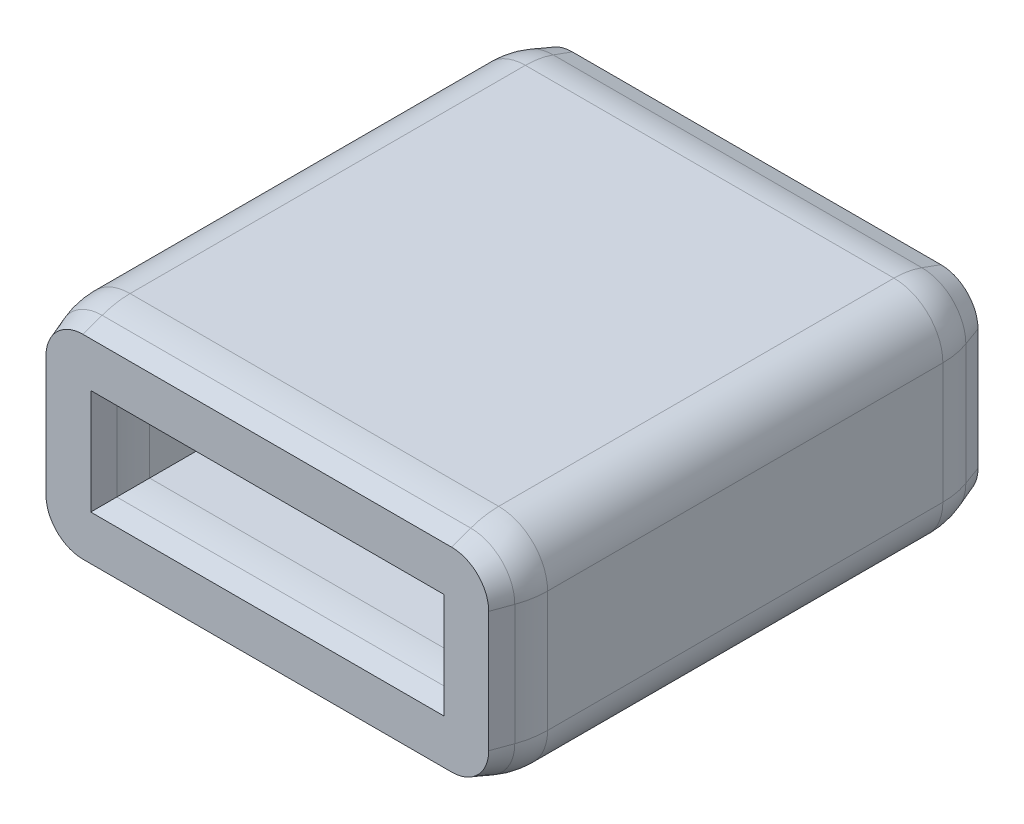
from build123d import *
from OCP.BRepFilletAPI import BRepFilletAPI_MakeChamfer

# Parameters (mm, degrees)
PROFILE_SKETCH_W         = 14.3
PROFILE_SKETCH_H         = 6.7
PROFILE_SKETCH_W_2       = 10.1
PROFILE_SKETCH_H_2       = 2.5
PROFILE_EXTRUDE_DEPTH    = 15
OUTSIDE_CORNER_FILLETS_R = 1.5
END_1_CHAMFER_SIZE       = 1
END_1_CHAMFER_SIZE2      = 0.363970234
END_2_CHAMFER_SIZE       = 1
END_2_CHAMFER_SIZE2      = 0.363970234
TRANSITION_FILLETS_R     = 2.5


with BuildPart() as part:
    # Profile Sketch → Profile Extrude (new body)
    with BuildSketch(Plane.XY):
        Rectangle(PROFILE_SKETCH_W, PROFILE_SKETCH_H)
        Rectangle(PROFILE_SKETCH_W_2, PROFILE_SKETCH_H_2, mode=Mode.SUBTRACT)
    extrude(amount=PROFILE_EXTRUDE_DEPTH)

    # Outside Corner Fillets
    outside_corner_fillets_edges = [part.edges().sort_by_distance(p)[0] for p in [
        (7.15, -3.35, 7.5),
        (-7.15, -3.35, 7.5),
        (-7.15, 3.35, 7.5),
        (7.15, 3.35, 7.5),
    ]]
    fillet(outside_corner_fillets_edges, radius=OUTSIDE_CORNER_FILLETS_R)

    # End 1 Chamfer: one chamfer whose edges measure the first distance from different faces: ONE call of the kernel's chamfer builder (chamfer() names one face for all edges)
    end_1_chamfer_edges_1 = [part.edges().sort_by_distance(p)[0] for p in [
        (5.05, 0, 15),
    ]]
    end_1_chamfer_side_1 = [part.faces().sort_by_distance(p)[0] for p in [
        (5.05, 0, 7.5),
    ]]
    end_1_chamfer_edges_2 = [part.edges().sort_by_distance(p)[0] for p in [
        (0, 1.25, 15),
    ]]
    end_1_chamfer_side_2 = [part.faces().sort_by_distance(p)[0] for p in [
        (0, 1.25, 7.5),
    ]]
    end_1_chamfer_edges_3 = [part.edges().sort_by_distance(p)[0] for p in [
        (-5.05, 0, 15),
    ]]
    end_1_chamfer_side_3 = [part.faces().sort_by_distance(p)[0] for p in [
        (-5.05, 0, 7.5),
    ]]
    end_1_chamfer_edges_4 = [part.edges().sort_by_distance(p)[0] for p in [
        (0, -1.25, 15),
    ]]
    end_1_chamfer_side_4 = [part.faces().sort_by_distance(p)[0] for p in [
        (0, -1.25, 7.5),
    ]]
    end_1_chamfer_edges_5 = [part.edges().sort_by_distance(p)[0] for p in [
        (0, 3.35, 0),
    ]]
    end_1_chamfer_side_5 = [part.faces().sort_by_distance(p)[0] for p in [
        (0, 3.35, 7.5),
    ]]
    end_1_chamfer_edges_6 = [part.edges().sort_by_distance(p)[0] for p in [
        (7.15, 0, 0),
    ]]
    end_1_chamfer_side_6 = [part.faces().sort_by_distance(p)[0] for p in [
        (7.15, 0, 7.5),
    ]]
    end_1_chamfer_edges_7 = [part.edges().sort_by_distance(p)[0] for p in [
        (0, -3.35, 0),
    ]]
    end_1_chamfer_side_7 = [part.faces().sort_by_distance(p)[0] for p in [
        (0, -3.35, 7.5),
    ]]
    end_1_chamfer_edges_8 = [part.edges().sort_by_distance(p)[0] for p in [
        (-7.15, 0, 0),
    ]]
    end_1_chamfer_side_8 = [part.faces().sort_by_distance(p)[0] for p in [
        (-7.15, 0, 7.5),
    ]]
    end_1_chamfer_edges_9 = [part.edges().sort_by_distance(p)[0] for p in [
        (-6.710660172, -2.910660172, 0),
    ]]
    end_1_chamfer_side_9 = [part.faces().sort_by_distance(p)[0] for p in [
        (-6.710660172, -2.910660172, 7.5),
    ]]
    end_1_chamfer_edges_10 = [part.edges().sort_by_distance(p)[0] for p in [
        (-6.710660172, 2.910660172, 0),
    ]]
    end_1_chamfer_side_10 = [part.faces().sort_by_distance(p)[0] for p in [
        (-6.710660172, 2.910660172, 7.5),
    ]]
    end_1_chamfer_edges_11 = [part.edges().sort_by_distance(p)[0] for p in [
        (6.710660172, -2.910660172, 0),
    ]]
    end_1_chamfer_side_11 = [part.faces().sort_by_distance(p)[0] for p in [
        (6.710660172, -2.910660172, 7.5),
    ]]
    end_1_chamfer_edges_12 = [part.edges().sort_by_distance(p)[0] for p in [
        (6.710660172, 2.910660172, 0),
    ]]
    end_1_chamfer_side_12 = [part.faces().sort_by_distance(p)[0] for p in [
        (6.710660172, 2.910660172, 7.5),
    ]]
    end_1_chamfer = BRepFilletAPI_MakeChamfer(part.part.solid().wrapped)
    for e in end_1_chamfer_edges_1:
        end_1_chamfer.Add(END_1_CHAMFER_SIZE, END_1_CHAMFER_SIZE2, e.wrapped, end_1_chamfer_side_1[0].wrapped)  # the first distance lies on this face
    for e in end_1_chamfer_edges_2:
        end_1_chamfer.Add(END_1_CHAMFER_SIZE, END_1_CHAMFER_SIZE2, e.wrapped, end_1_chamfer_side_2[0].wrapped)  # the first distance lies on this face
    for e in end_1_chamfer_edges_3:
        end_1_chamfer.Add(END_1_CHAMFER_SIZE, END_1_CHAMFER_SIZE2, e.wrapped, end_1_chamfer_side_3[0].wrapped)  # the first distance lies on this face
    for e in end_1_chamfer_edges_4:
        end_1_chamfer.Add(END_1_CHAMFER_SIZE, END_1_CHAMFER_SIZE2, e.wrapped, end_1_chamfer_side_4[0].wrapped)  # the first distance lies on this face
    for e in end_1_chamfer_edges_5:
        end_1_chamfer.Add(END_1_CHAMFER_SIZE, END_1_CHAMFER_SIZE2, e.wrapped, end_1_chamfer_side_5[0].wrapped)  # the first distance lies on this face
    for e in end_1_chamfer_edges_6:
        end_1_chamfer.Add(END_1_CHAMFER_SIZE, END_1_CHAMFER_SIZE2, e.wrapped, end_1_chamfer_side_6[0].wrapped)  # the first distance lies on this face
    for e in end_1_chamfer_edges_7:
        end_1_chamfer.Add(END_1_CHAMFER_SIZE, END_1_CHAMFER_SIZE2, e.wrapped, end_1_chamfer_side_7[0].wrapped)  # the first distance lies on this face
    for e in end_1_chamfer_edges_8:
        end_1_chamfer.Add(END_1_CHAMFER_SIZE, END_1_CHAMFER_SIZE2, e.wrapped, end_1_chamfer_side_8[0].wrapped)  # the first distance lies on this face
    for e in end_1_chamfer_edges_9:
        end_1_chamfer.Add(END_1_CHAMFER_SIZE, END_1_CHAMFER_SIZE2, e.wrapped, end_1_chamfer_side_9[0].wrapped)  # the first distance lies on this face
    for e in end_1_chamfer_edges_10:
        end_1_chamfer.Add(END_1_CHAMFER_SIZE, END_1_CHAMFER_SIZE2, e.wrapped, end_1_chamfer_side_10[0].wrapped)  # the first distance lies on this face
    for e in end_1_chamfer_edges_11:
        end_1_chamfer.Add(END_1_CHAMFER_SIZE, END_1_CHAMFER_SIZE2, e.wrapped, end_1_chamfer_side_11[0].wrapped)  # the first distance lies on this face
    for e in end_1_chamfer_edges_12:
        end_1_chamfer.Add(END_1_CHAMFER_SIZE, END_1_CHAMFER_SIZE2, e.wrapped, end_1_chamfer_side_12[0].wrapped)  # the first distance lies on this face
    add(Compound.cast(end_1_chamfer.Shape()), mode=Mode.REPLACE)

    # End 2 Chamfer: one chamfer whose edges measure the first distance from different faces: ONE call of the kernel's chamfer builder (chamfer() names one face for all edges)
    end_2_chamfer_edges_1 = [part.edges().sort_by_distance(p)[0] for p in [
        (5.05, 0, 0),
    ]]
    end_2_chamfer_side_1 = [part.faces().sort_by_distance(p)[0] for p in [
        (5.05, 0, 7),
    ]]
    end_2_chamfer_edges_2 = [part.edges().sort_by_distance(p)[0] for p in [
        (0, 1.25, 0),
    ]]
    end_2_chamfer_side_2 = [part.faces().sort_by_distance(p)[0] for p in [
        (0, 1.25, 7),
    ]]
    end_2_chamfer_edges_3 = [part.edges().sort_by_distance(p)[0] for p in [
        (-5.05, 0, 0),
    ]]
    end_2_chamfer_side_3 = [part.faces().sort_by_distance(p)[0] for p in [
        (-5.05, 0, 7),
    ]]
    end_2_chamfer_edges_4 = [part.edges().sort_by_distance(p)[0] for p in [
        (0, -1.25, 0),
    ]]
    end_2_chamfer_side_4 = [part.faces().sort_by_distance(p)[0] for p in [
        (0, -1.25, 7),
    ]]
    end_2_chamfer_edges_5 = [part.edges().sort_by_distance(p)[0] for p in [
        (0, 3.35, 15),
    ]]
    end_2_chamfer_side_5 = [part.faces().sort_by_distance(p)[0] for p in [
        (0, 3.35, 8),
    ]]
    end_2_chamfer_edges_6 = [part.edges().sort_by_distance(p)[0] for p in [
        (7.15, 0, 15),
    ]]
    end_2_chamfer_side_6 = [part.faces().sort_by_distance(p)[0] for p in [
        (7.15, 0, 8),
    ]]
    end_2_chamfer_edges_7 = [part.edges().sort_by_distance(p)[0] for p in [
        (-7.15, 0, 15),
    ]]
    end_2_chamfer_side_7 = [part.faces().sort_by_distance(p)[0] for p in [
        (-7.15, 0, 8),
    ]]
    end_2_chamfer_edges_8 = [part.edges().sort_by_distance(p)[0] for p in [
        (0, -3.35, 15),
    ]]
    end_2_chamfer_side_8 = [part.faces().sort_by_distance(p)[0] for p in [
        (0, -3.35, 8),
    ]]
    end_2_chamfer_edges_9 = [part.edges().sort_by_distance(p)[0] for p in [
        (-6.710660172, -2.910660172, 15),
    ]]
    end_2_chamfer_side_9 = [part.faces().sort_by_distance(p)[0] for p in [
        (-6.710660172, -2.910660172, 8),
    ]]
    end_2_chamfer_edges_10 = [part.edges().sort_by_distance(p)[0] for p in [
        (-6.710660172, 2.910660172, 15),
    ]]
    end_2_chamfer_side_10 = [part.faces().sort_by_distance(p)[0] for p in [
        (-6.710660172, 2.910660172, 8),
    ]]
    end_2_chamfer_edges_11 = [part.edges().sort_by_distance(p)[0] for p in [
        (6.710660172, -2.910660172, 15),
    ]]
    end_2_chamfer_side_11 = [part.faces().sort_by_distance(p)[0] for p in [
        (6.710660172, -2.910660172, 8),
    ]]
    end_2_chamfer_edges_12 = [part.edges().sort_by_distance(p)[0] for p in [
        (6.710660172, 2.910660172, 15),
    ]]
    end_2_chamfer_side_12 = [part.faces().sort_by_distance(p)[0] for p in [
        (6.710660172, 2.910660172, 8),
    ]]
    end_2_chamfer = BRepFilletAPI_MakeChamfer(part.part.solid().wrapped)
    for e in end_2_chamfer_edges_1:
        end_2_chamfer.Add(END_2_CHAMFER_SIZE, END_2_CHAMFER_SIZE2, e.wrapped, end_2_chamfer_side_1[0].wrapped)  # the first distance lies on this face
    for e in end_2_chamfer_edges_2:
        end_2_chamfer.Add(END_2_CHAMFER_SIZE, END_2_CHAMFER_SIZE2, e.wrapped, end_2_chamfer_side_2[0].wrapped)  # the first distance lies on this face
    for e in end_2_chamfer_edges_3:
        end_2_chamfer.Add(END_2_CHAMFER_SIZE, END_2_CHAMFER_SIZE2, e.wrapped, end_2_chamfer_side_3[0].wrapped)  # the first distance lies on this face
    for e in end_2_chamfer_edges_4:
        end_2_chamfer.Add(END_2_CHAMFER_SIZE, END_2_CHAMFER_SIZE2, e.wrapped, end_2_chamfer_side_4[0].wrapped)  # the first distance lies on this face
    for e in end_2_chamfer_edges_5:
        end_2_chamfer.Add(END_2_CHAMFER_SIZE, END_2_CHAMFER_SIZE2, e.wrapped, end_2_chamfer_side_5[0].wrapped)  # the first distance lies on this face
    for e in end_2_chamfer_edges_6:
        end_2_chamfer.Add(END_2_CHAMFER_SIZE, END_2_CHAMFER_SIZE2, e.wrapped, end_2_chamfer_side_6[0].wrapped)  # the first distance lies on this face
    for e in end_2_chamfer_edges_7:
        end_2_chamfer.Add(END_2_CHAMFER_SIZE, END_2_CHAMFER_SIZE2, e.wrapped, end_2_chamfer_side_7[0].wrapped)  # the first distance lies on this face
    for e in end_2_chamfer_edges_8:
        end_2_chamfer.Add(END_2_CHAMFER_SIZE, END_2_CHAMFER_SIZE2, e.wrapped, end_2_chamfer_side_8[0].wrapped)  # the first distance lies on this face
    for e in end_2_chamfer_edges_9:
        end_2_chamfer.Add(END_2_CHAMFER_SIZE, END_2_CHAMFER_SIZE2, e.wrapped, end_2_chamfer_side_9[0].wrapped)  # the first distance lies on this face
    for e in end_2_chamfer_edges_10:
        end_2_chamfer.Add(END_2_CHAMFER_SIZE, END_2_CHAMFER_SIZE2, e.wrapped, end_2_chamfer_side_10[0].wrapped)  # the first distance lies on this face
    for e in end_2_chamfer_edges_11:
        end_2_chamfer.Add(END_2_CHAMFER_SIZE, END_2_CHAMFER_SIZE2, e.wrapped, end_2_chamfer_side_11[0].wrapped)  # the first distance lies on this face
    for e in end_2_chamfer_edges_12:
        end_2_chamfer.Add(END_2_CHAMFER_SIZE, END_2_CHAMFER_SIZE2, e.wrapped, end_2_chamfer_side_12[0].wrapped)  # the first distance lies on this face
    add(Compound.cast(end_2_chamfer.Shape()), mode=Mode.REPLACE)

    # Transition Fillets
    transition_fillets_edges = [part.edges().sort_by_distance(p)[0] for p in [
        (0, -3.35, 14),
        (6.710660172, -2.910660172, 14),
        (-6.710660172, -2.910660172, 14),
        (7.15, 0, 14),
        (-7.15, 0, 14),
        (6.710660172, 2.910660172, 14),
        (-6.710660172, 2.910660172, 14),
        (0, 3.35, 14),
        (5.05, 0, 14),
        (0, 1.25, 14),
        (-5.05, 0, 14),
        (0, -1.25, 14),
        (0, -3.35, 1),
        (6.710660172, -2.910660172, 1),
        (-6.710660172, -2.910660172, 1),
        (7.15, 0, 1),
        (-7.15, 0, 1),
        (6.710660172, 2.910660172, 1),
        (-6.710660172, 2.910660172, 1),
        (0, 3.35, 1),
        (5.05, 0, 1),
        (0, 1.25, 1),
        (-5.05, 0, 1),
        (0, -1.25, 1),
    ]]
    fillet(transition_fillets_edges, radius=TRANSITION_FILLETS_R)


solid = part.part
